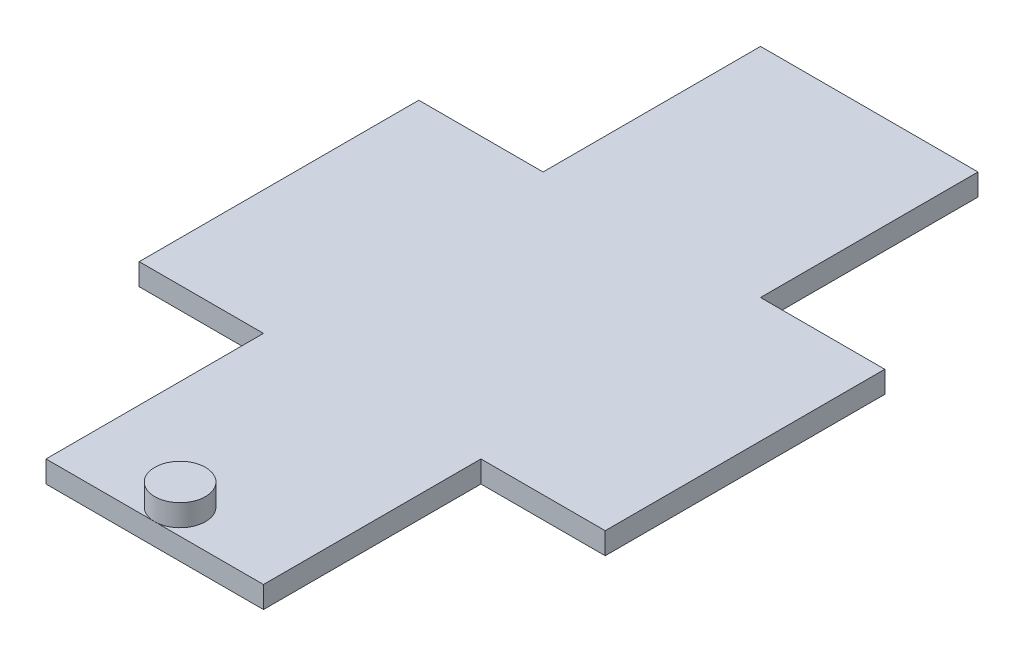
from build123d import *

# Parameters (mm, degrees)
EXTRUDE_2_DEPTH = 7
SKETCH_4_R      = 8.164253287
EXTRUDE_3_DEPTH = 7


with BuildPart() as part:
    # 草图2 → 凸台-拉伸2 (new body)
    with BuildSketch(Plane(origin=(0, 0, 0), x_dir=(1, 0, 0), z_dir=(0, 1, 0))):
        Polygon((0, 230), (0, 160), (-40, 160), (-40, 70), (0, 70), (0, 0), (70, 0), (70, 70), (110, 70), (110, 160), (70, 160), (70, 230), align=None)
    extrude(amount=EXTRUDE_2_DEPTH)

    # 草图4 → 凸台-拉伸3 (add)
    with BuildSketch(Plane(origin=(0, 7, 0), x_dir=(1, 0, 0), z_dir=(0, 1, 0))):
        with Locations(Location((35, 8.164253287, 0), (0, 0, 270))):
            Circle(SKETCH_4_R)
    extrude(amount=EXTRUDE_3_DEPTH)


solid = part.part
